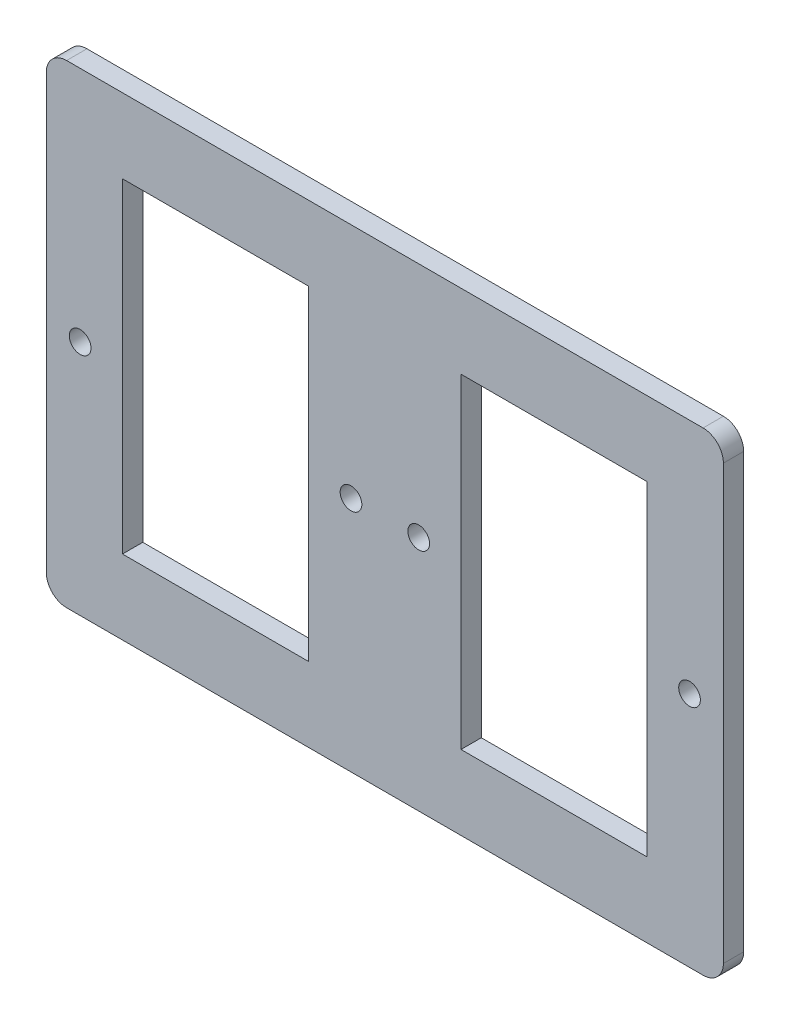
from build123d import *

# Parameters (mm, degrees)
SKETCH1_W            = 100
SKETCH1_H            = 70
SKETCH1_W_2          = 27.5
SKETCH1_H_2          = 48
BOSS_EXTRUDE1_DEPTH  = 3
M3_CLEARANCE_HOLE1_D = 3.2
FILLET1_R            = 3


with BuildPart() as part:
    # Sketch1 → Boss-Extrude1 (new body)
    with BuildSketch(Plane.XY):
        Rectangle(SKETCH1_W, SKETCH1_H)
        with Locations((-25, 0)):
            Rectangle(SKETCH1_W_2, SKETCH1_H_2, mode=Mode.SUBTRACT)
        with Locations((25, 0)):
            Rectangle(SKETCH1_W_2, SKETCH1_H_2, mode=Mode.SUBTRACT)
    extrude(amount=BOSS_EXTRUDE1_DEPTH)

    # M3 Clearance Hole1 (through all)
    with Locations(Plane.XY.offset(3)):
        with Locations((-45, 0), (-5, 0), (45, 0), (5, 0)):
            Hole(M3_CLEARANCE_HOLE1_D / 2)

    # Fillet1
    fillet1_edges = [part.edges().sort_by_distance(p)[0] for p in [
        (-50, 35, 1.5),
        (50, 35, 1.5),
        (50, -35, 1.5),
        (-50, -35, 1.5),
    ]]
    fillet(fillet1_edges, radius=FILLET1_R)


solid = part.part
